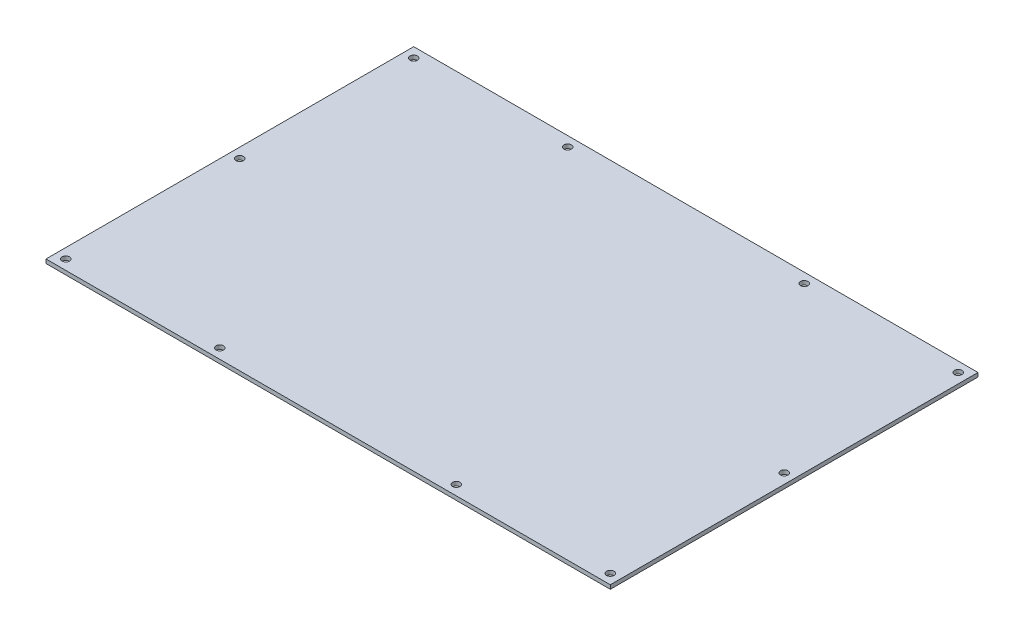
from build123d import *

# Parameters (mm, degrees)
SKETCH1_W           = 227.86
SKETCH1_H           = 148.48
SKETCH1_R           = 1.5
BOSS_EXTRUDE2_DEPTH = 1.6


with BuildPart() as part:
    # Sketch1 → Boss-Extrude2 (new body)
    with BuildSketch(Plane(origin=(0, 0, 0), x_dir=(1, 0, 0), z_dir=(0, 1, 0))):
        with Locations((113.93, 74.24)):
            Rectangle(SKETCH1_W, SKETCH1_H)
        with Locations(Location((223.86, 74.24, 0), (0, 0, 270))):
            Circle(SKETCH1_R, mode=Mode.SUBTRACT)
        with Locations(Location((4, 74.24, 0), (0, 0, 90))):
            Circle(SKETCH1_R, mode=Mode.SUBTRACT)
        with Locations(Location((66.18, 4, 0), (0, 0, 270))):
            Circle(SKETCH1_R, mode=Mode.SUBTRACT)
        with Locations(Location((161.68, 4, 0), (0, 0, 270))):
            Circle(SKETCH1_R, mode=Mode.SUBTRACT)
        with Locations(Location((161.68, 144.48, 0), (0, 0, 270))):
            Circle(SKETCH1_R, mode=Mode.SUBTRACT)
        with Locations(Location((66.18, 144.48, 0), (0, 0, 270))):
            Circle(SKETCH1_R, mode=Mode.SUBTRACT)
        with Locations(Location((223.86, 4, 0), (0, 0, 270))):
            Circle(SKETCH1_R, mode=Mode.SUBTRACT)
        with Locations(Location((4, 4, 0), (0, 0, 90))):
            Circle(SKETCH1_R, mode=Mode.SUBTRACT)
        with Locations(Location((4, 144.48, 0), (0, 0, 270))):
            Circle(SKETCH1_R, mode=Mode.SUBTRACT)
        with Locations(Location((223.86, 144.48, 0), (0, 0, 90))):
            Circle(SKETCH1_R, mode=Mode.SUBTRACT)
    extrude(amount=BOSS_EXTRUDE2_DEPTH)


solid = part.part
